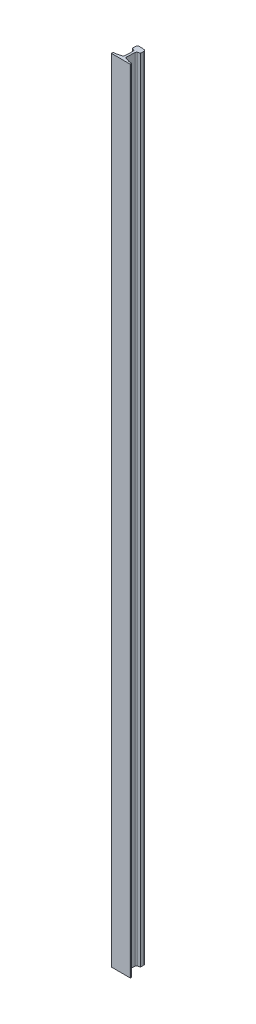
from build123d import *

# Parameters (mm, degrees)
BOSS_EXTRUDE1_DEPTH = 6160
SCALE1_SCALE        = 0.5


with BuildPart() as part:
    # Sketch1 → Boss-Extrude1 (new body)
    with BuildSketch(Plane(origin=(0, 0, 0), x_dir=(1, 0, 0), z_dir=(0, 1, 0))):
        with BuildLine():
            Line((76.57, 1), (76.57, 8.014887848))
            ThreePointArc((76.57, 8.014887848), (75.794355641, 10.027905976), (73.868505345, 11))
            Line((73.868505345, 11), (52.699440994, 13.462245993))
            ThreePointArc((52.699440994, 13.462245993), (50.66951347, 13.805020581), (48.685575878, 14.354649366))
            Line((48.685575878, 14.354649366), (18.685575878, 24.354649366))
            ThreePointArc((18.685575878, 24.354649366), (13.871556702, 29.074301457), (12.362010068, 35.644778262))
            Line((12.362010068, 35.644778262), (15.471988543, 97.852031369))
            ThreePointArc((15.471988543, 97.852031369), (18.068983959, 104.780820885), (24.236586355, 108.868997747))
            Line((24.236586355, 108.868997747), (40.625152803, 113.436411952))
            ThreePointArc((40.625152803, 113.436411952), (41.681001919, 114.153421136), (42.088224459, 115.363003431))
            Line((42.088224459, 115.363003431), (42.088077354, 139.600936252))
            ThreePointArc((42.088077354, 139.600936252), (38.946677156, 148.309556467), (30.806533774, 152.719378115))
            ThreePointArc((30.806533774, 152.719378115), (10.309376952, 154.806660207), (-10.293756951, 154.774138824))
            ThreePointArc((-10.293756951, 154.774138824), (-18.835211019, 151.19935214), (-22.830844668, 142.846481426))
            Line((-22.830844668, 142.846481426), (-25.249616021, 118.672382628))
            ThreePointArc((-25.249616021, 118.672382628), (-24.964931452, 117.428427653), (-23.98595767, 116.609843742))
            Line((-23.98595767, 116.609843742), (-8.134655987, 110.430635238))
            ThreePointArc((-8.134655987, 110.430635238), (-2.419976919, 105.771805576), (-0.508053801, 98.650934796))
            Line((-0.508053801, 98.650934796), (-3.579408779, 36.946097875))
            ThreePointArc((-3.579408779, 36.946097875), (-6.090257895, 30.180503672), (-12.02744702, 26.078380623))
            Line((-12.02744702, 26.078380623), (-40.856592509, 17.185955753))
            ThreePointArc((-40.856592509, 17.185955753), (-42.789347985, 16.693858065), (-44.761504941, 16.396703557))
            Line((-44.761504941, 16.396703557), (-68.728511515, 14))
            ThreePointArc((-68.728511515, 14), (-70.654357721, 13.027904294), (-71.43, 11.014888465))
            Line((-71.43, 11.014888465), (-71.43, 1))
            ThreePointArc((-71.43, 1), (-71.137106781, 0.292893219), (-70.43, 0))
            Line((-70.43, 0), (2.57, 0))
            Line((2.57, 0), (75.57, 0))
            ThreePointArc((75.57, 0), (76.277106781, 0.292893219), (76.57, 1))
        make_face()
    extrude(amount=BOSS_EXTRUDE1_DEPTH)


with BuildPart() as part_1:
    # Scale1: scaled about (4.948874478, 3080, -70.189428705)
    add(part.part.scale(SCALE1_SCALE).moved(Location((2.474437239, 1540, -35.094714352))))


solid = part_1.part
